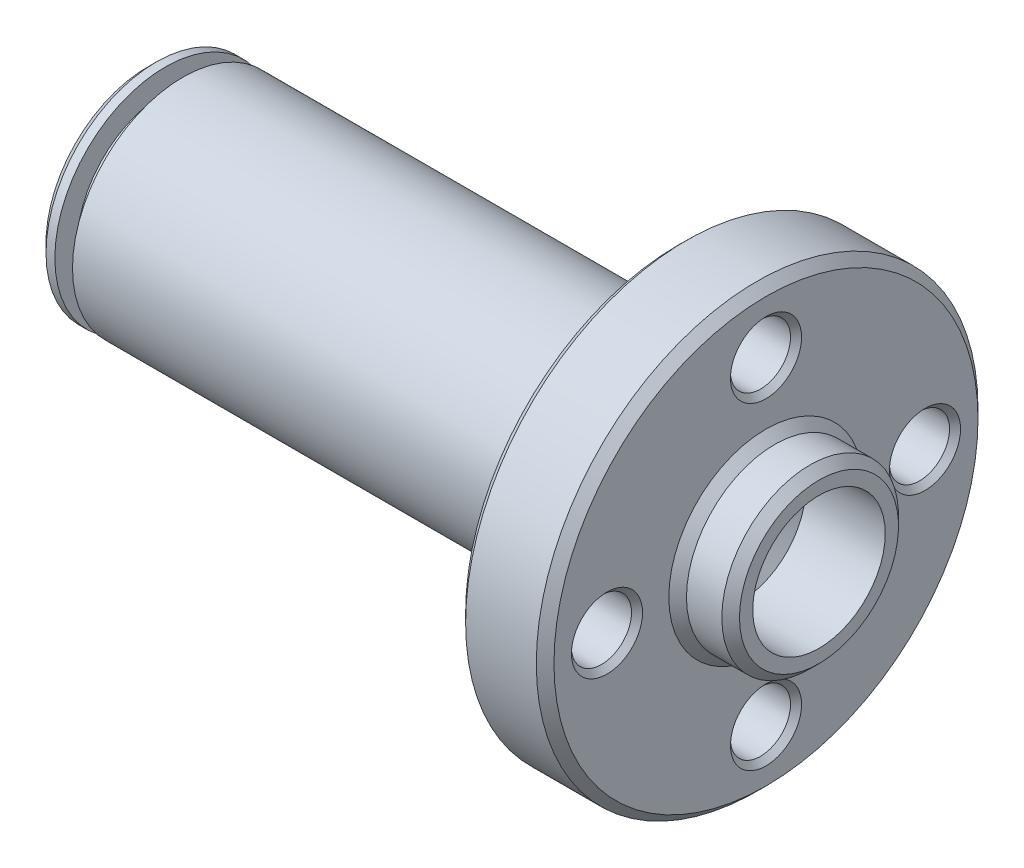
from build123d import *

# Parameters (mm, degrees)
CHAMFER1_SIZE                  = 1
M8_TAPPED_HOLE1_D              = 6.8
M8_TAPPED_HOLE1_CSINK_D        = 8.05
M8_TAPPED_HOLE1_CSINK_ANGLE    = 90
F_15_0_15_DIAMETER_HOLE1_D     = 15
F_15_0_15_DIAMETER_HOLE1_DEPTH = 9
F_15_0_15_DIAMETER_HOLE1_TIP   = 4.506454643


with BuildPart() as part:
    # Sketch1 → Revolve1 (revolve)
    with BuildSketch(Plane.XY, mode=Mode.PRIVATE) as revolve1_sk:
        Polygon((0, 6), (0, 12.5), (2, 12.5), (2, 10), (4, 10), (4, 12.5), (56.7, 12.5), (56.7, 16.5), (60, 16.5), (60, 25), (70, 25), (70, 10), (76, 10), (76, 0), (28.749216111, 0), (25, 6), align=None)
    revolve(revolve1_sk.sketch.rotate(Axis((-14.460784314, 0, 0), (1, 0, 0)), 90), axis=Axis((-14.460784314, 0, 0), (1, 0, 0)))

    # Chamfer1
    chamfer1_edges = [part.edges().sort_by_distance(p)[0] for p in [
        (0, 0, -12.5),
        (0, 0, -6),
        (76, 0, -10),
        (70, 0, -10),
        (70, 0, -25),
        (60, 0, -25),
        (60, 0, -16.5),
        (56.7, 0, -16.5),
        (56.7, 0, -12.5),
    ]]
    chamfer(chamfer1_edges, length=CHAMFER1_SIZE)

    # M8 Tapped Hole1 (through all)
    with Locations(Plane(origin=(70, 0, 0), x_dir=(0, 0, -1), z_dir=(1, 0, 0))):
        with Locations((0, 18), (18, 0), (-18, 0), (0, -18)):
            CounterSinkHole(M8_TAPPED_HOLE1_D / 2, M8_TAPPED_HOLE1_CSINK_D / 2, counter_sink_angle=M8_TAPPED_HOLE1_CSINK_ANGLE)

    # Ø15.0 (15) Diameter Hole1
    with Locations(Plane(origin=(76, 0, 0), x_dir=(0, 0, -1), z_dir=(1, 0, 0))):
        with Locations((0, 0)):
            Hole(F_15_0_15_DIAMETER_HOLE1_D / 2, depth=F_15_0_15_DIAMETER_HOLE1_DEPTH)
            with Locations((0, 0, -(F_15_0_15_DIAMETER_HOLE1_DEPTH + F_15_0_15_DIAMETER_HOLE1_TIP / 2))):  # 118° drill point
                Cone(0, F_15_0_15_DIAMETER_HOLE1_D / 2, F_15_0_15_DIAMETER_HOLE1_TIP, mode=Mode.SUBTRACT)


solid = part.part
